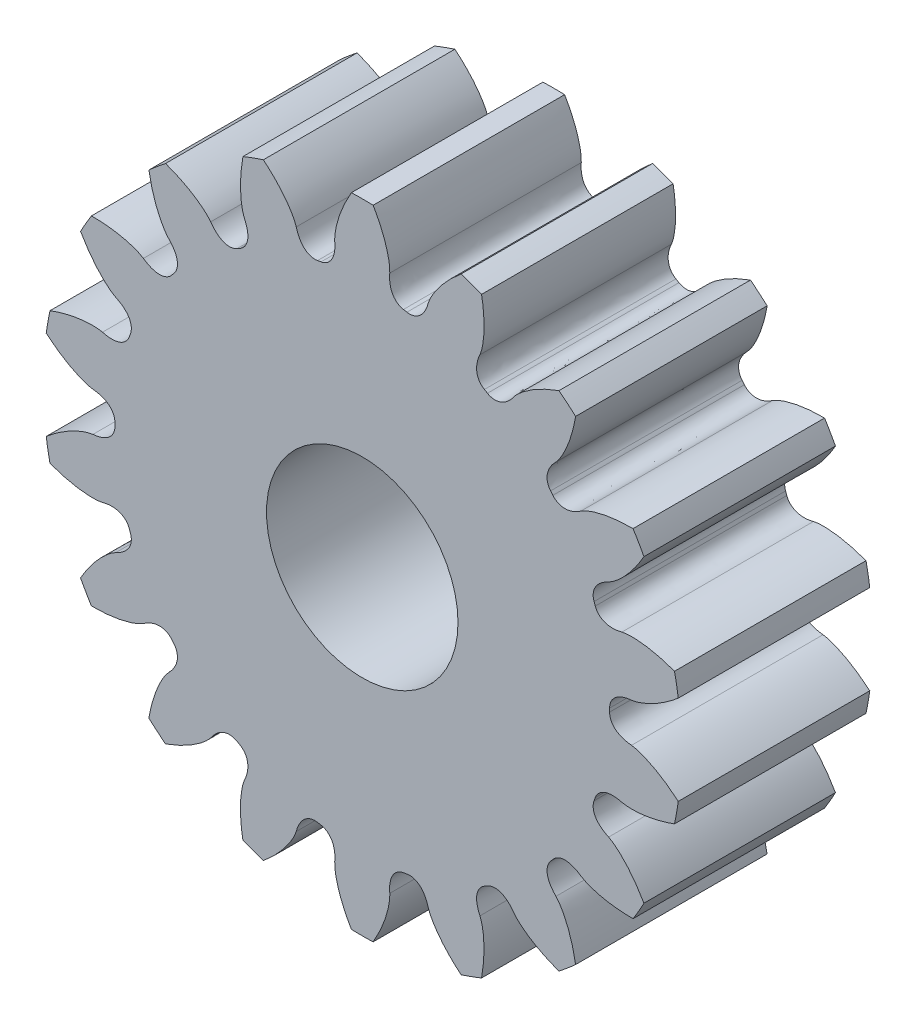
from build123d import *

# Parameters (mm, degrees)
EXTRUDE1_DEPTH = 3
SKETCH2_R      = 1.5
EXTRUDE2_DEPTH = 8.649188423


with BuildPart() as part:
    # Model → Extrude1 (new body)
    with BuildSketch(Plane.XY):
        with BuildLine():
            ThreePointArc((0.170382954, 4.997096122), (0, 5), (-0.170382954, 4.997096122))
            add(Edge.make_bspline(
                [(-0.43135347, 4.207267466), (-0.431951062, 4.236199501), (-0.430964789, 4.264988509), (-0.428394651, 4.293634492), (-0.425770912, 4.322877894), (-0.420909378, 4.352020022), (-0.415571578, 4.380917537), (-0.41012826, 4.410386301), (-0.403350915, 4.43967045), (-0.395923916, 4.46870975), (-0.388353419, 4.498310119), (-0.379730019, 4.52768866), (-0.370476347, 4.556810235), (-0.361047462, 4.586483212), (-0.350716716, 4.615909272), (-0.339787808, 4.645065279), (-0.328655911, 4.67476282), (-0.316719407, 4.704193559), (-0.304215266, 4.733341371), (-0.291483172, 4.763020553), (-0.278015717, 4.792415808), (-0.26400773, 4.821515626), (-0.249748986, 4.85113636), (-0.234807532, 4.880457696), (-0.219349459, 4.909471425), (-0.203619566, 4.938995344), (-0.187297397, 4.968203576), (-0.170382954, 4.997096122)],
                knots=[0, 0, 0, 0, 1, 1, 1, 2, 2, 2, 3, 3, 3, 4, 4, 4, 5, 5, 5, 6, 6, 6, 7, 7, 7, 8, 8, 8, 9, 9, 9, 9], degree=3))
            add(Edge.make_bspline(
                [(-0.43135347, 4.207267466), (-0.426410983, 4.162768285), (-0.427129765, 4.118945491), (-0.433509815, 4.075799084), (-0.437167481, 4.051063365), (-0.442075917, 4.025979343), (-0.450064877, 4.00225885), (-0.45584876, 3.98508558), (-0.46276282, 3.967979094), (-0.471301457, 3.951985875), (-0.478339128, 3.938804027), (-0.486355451, 3.925906001), (-0.495389481, 3.913998251), (-0.503410661, 3.903425539), (-0.512275301, 3.893279379), (-0.52182913, 3.884065211), (-0.530697966, 3.875511683), (-0.540288786, 3.867492833), (-0.550350294, 3.860378481), (-0.559957369, 3.853585452), (-0.570172172, 3.847415715), (-0.580688018, 3.842136144), (-0.590923912, 3.836997125), (-0.601655598, 3.832557088), (-0.612541957, 3.828996435), (-0.623293412, 3.825479906), (-0.634306636, 3.822762449), (-0.645581629, 3.820844064)],
                knots=[0, 0, 0, 0, 1, 1, 1, 2, 2, 2, 3, 3, 3, 4, 4, 4, 5, 5, 5, 6, 6, 6, 7, 7, 7, 8, 8, 8, 9, 9, 9, 9], degree=3))
            ThreePointArc((-0.645581629, 3.820844064), (-0.672886688, 3.816130043), (-0.700157341, 3.811220893))
            add(Edge.make_bspline(
                [(-1.033630549, 4.101069767), (-1.023055352, 4.057563785), (-1.007391639, 4.016629667), (-0.986639413, 3.978267412), (-0.974742217, 3.956274435), (-0.961550555, 3.934381948), (-0.945930501, 3.914824361), (-0.934621825, 3.900664971), (-0.922273971, 3.88695488), (-0.908780274, 3.874846556), (-0.897658569, 3.864866696), (-0.885714305, 3.85548826), (-0.873152403, 3.847388455), (-0.861998879, 3.840196761), (-0.850198651, 3.833694375), (-0.838069558, 3.828303491), (-0.826810099, 3.823299124), (-0.815055067, 3.819044124), (-0.803167091, 3.815800059), (-0.791816041, 3.812702513), (-0.780107092, 3.810398525), (-0.768419709, 3.809033981), (-0.757043467, 3.807705765), (-0.745440399, 3.807203948), (-0.733992753, 3.807581383), (-0.722686966, 3.807954141), (-0.711408495, 3.809167311), (-0.700157341, 3.811220893)],
                knots=[0, 0, 0, 0, 1, 1, 1, 2, 2, 2, 3, 3, 3, 4, 4, 4, 5, 5, 5, 6, 6, 6, 7, 7, 7, 8, 8, 8, 9, 9, 9, 9], degree=3))
            add(Edge.make_bspline(
                [(-1.033630549, 4.101069767), (-1.042964335, 4.128461375), (-1.053737549, 4.155176869), (-1.065950192, 4.181216248), (-1.078417533, 4.207798686), (-1.092953075, 4.233520587), (-1.107852498, 4.258849733), (-1.123046455, 4.284679588), (-1.139430845, 4.309879699), (-1.156341967, 4.334627531), (-1.17357983, 4.359853517), (-1.191731228, 4.384510939), (-1.210387, 4.408711326), (-1.229396009, 4.433369934), (-1.249168041, 4.457488062), (-1.269409797, 4.481147841), (-1.290027516, 4.505247067), (-1.311310066, 4.528820391), (-1.333029253, 4.551933707), (-1.355144386, 4.575468383), (-1.377853424, 4.598484746), (-1.400969349, 4.621038616), (-1.424499074, 4.643996224), (-1.448567936, 4.666438989), (-1.473017052, 4.688416004), (-1.497896092, 4.710779472), (-1.523223717, 4.732643722), (-1.548999928, 4.754008753)],
                knots=[0, 0, 0, 0, 1, 1, 1, 2, 2, 2, 3, 3, 3, 4, 4, 4, 5, 5, 5, 6, 6, 6, 7, 7, 7, 8, 8, 8, 9, 9, 9, 9], degree=3))
            ThreePointArc((-1.548999928, 4.754008753), (-1.710100717, 4.698463104), (-1.869215136, 4.637459949))
            add(Edge.make_bspline(
                [(-1.844309894, 3.806006616), (-1.854766786, 3.832989447), (-1.863686414, 3.860379591), (-1.871068777, 3.888177048), (-1.878605101, 3.91655423), (-1.884003949, 3.945601615), (-1.888871589, 3.974582031), (-1.893835454, 4.004135335), (-1.897482602, 4.033971423), (-1.900435531, 4.063799622), (-1.903445513, 4.094204133), (-1.905390221, 4.124760307), (-1.90665478, 4.155290579), (-1.907943282, 4.186398925), (-1.908299861, 4.2175837), (-1.908001988, 4.248719291), (-1.907698584, 4.280433184), (-1.906547845, 4.312171557), (-1.904766935, 4.343838209), (-1.902953558, 4.37608215), (-1.90035206, 4.408310795), (-1.897141581, 4.440446693), (-1.893873632, 4.473157856), (-1.889861745, 4.505821177), (-1.885259189, 4.538372137), (-1.880575699, 4.571495486), (-1.875227681, 4.604524757), (-1.869215136, 4.637459949)],
                knots=[0, 0, 0, 0, 1, 1, 1, 2, 2, 2, 3, 3, 3, 4, 4, 4, 5, 5, 5, 6, 6, 6, 7, 7, 7, 8, 8, 8, 9, 9, 9, 9], degree=3))
            add(Edge.make_bspline(
                [(-1.844309894, 3.806006616), (-1.824445859, 3.765881494), (-1.810133015, 3.7244557), (-1.801371361, 3.681729234), (-1.796348328, 3.657234266), (-1.792381509, 3.631984211), (-1.791775789, 3.606961854), (-1.791337258, 3.588846055), (-1.791983586, 3.570406468), (-1.794537277, 3.552457372), (-1.796642067, 3.537663462), (-1.799763561, 3.522801538), (-1.804180083, 3.508522093), (-1.808101446, 3.495843588), (-1.812961291, 3.483277431), (-1.818787523, 3.471351344), (-1.824196023, 3.460280336), (-1.830465839, 3.449464828), (-1.837487312, 3.439338286), (-1.844191657, 3.429669113), (-1.851680257, 3.420377789), (-1.8597562, 3.411819983), (-1.867617146, 3.403490003), (-1.87618305, 3.39564728), (-1.885195066, 3.388578007), (-1.894095406, 3.381596337), (-1.903515026, 3.375276018), (-1.913453928, 3.369617051)],
                knots=[0, 0, 0, 0, 1, 1, 1, 2, 2, 2, 3, 3, 3, 4, 4, 4, 5, 5, 5, 6, 6, 6, 7, 7, 7, 8, 8, 8, 9, 9, 9, 9], degree=3))
            ThreePointArc((-1.913453928, 3.369617051), (-1.9375, 3.35584844), (-1.961447003, 3.341908235))
            add(Edge.make_bspline(
                [(-2.373943469, 3.500222529), (-2.349126112, 3.462957209), (-2.320406744, 3.429849025), (-2.287785366, 3.400897977), (-2.269083617, 3.384300419), (-2.249199838, 3.368240026), (-2.227832701, 3.355204278), (-2.212363225, 3.345766599), (-2.19607091, 3.337106542), (-2.179249692, 3.330343556), (-2.165385394, 3.324769402), (-2.150953843, 3.320041734), (-2.136379221, 3.316726831), (-2.123438632, 3.313783578), (-2.110126099, 3.31170925), (-2.096884688, 3.31079187), (-2.084592663, 3.309940266), (-2.072091251, 3.309962331), (-2.059810672, 3.310979834), (-2.048084751, 3.311951381), (-2.036293927, 3.313791036), (-2.024844678, 3.316506106), (-2.013700231, 3.319148895), (-2.002625282, 3.322645824), (-1.991997104, 3.326915822), (-1.98150063, 3.331132907), (-1.971317263, 3.336130378), (-1.961447003, 3.341908235)],
                knots=[0, 0, 0, 0, 1, 1, 1, 2, 2, 2, 3, 3, 3, 4, 4, 4, 5, 5, 5, 6, 6, 6, 7, 7, 7, 8, 8, 8, 9, 9, 9, 9], degree=3))
            add(Edge.make_bspline(
                [(-2.373943469, 3.500222529), (-2.39208284, 3.522769878), (-2.411343587, 3.544189574), (-2.43172571, 3.564481617), (-2.452532908, 3.585196856), (-2.474989257, 3.604396088), (-2.497653214, 3.623101797), (-2.520765194, 3.642177282), (-2.544780429, 3.660253848), (-2.569135943, 3.677725259), (-2.593962031, 3.695534236), (-2.6194521, 3.712496489), (-2.645259812, 3.728856765), (-2.671556178, 3.745526813), (-2.698384696, 3.761428007), (-2.725497846, 3.776737838), (-2.753114585, 3.792332028), (-2.781176191, 3.807204646), (-2.809490771, 3.821495658), (-2.838321532, 3.836047199), (-2.867533107, 3.849908557), (-2.89696885, 3.863196151), (-2.926931522, 3.876721605), (-2.957224732, 3.88957887), (-2.987715968, 3.901868418), (-3.018743375, 3.914374072), (-3.050021571, 3.926257188), (-3.081550557, 3.937517767)],
                knots=[0, 0, 0, 0, 1, 1, 1, 2, 2, 2, 3, 3, 3, 4, 4, 4, 5, 5, 5, 6, 6, 6, 7, 7, 7, 8, 8, 8, 9, 9, 9, 9], degree=3))
            ThreePointArc((-3.081550557, 3.937517767), (-3.213938048, 3.830222216), (-3.342592386, 3.718477664))
            add(Edge.make_bspline(
                [(-3.034815326, 2.945685197), (-3.053870262, 2.967464297), (-3.071619951, 2.990151921), (-3.088064394, 3.013748069), (-3.10485179, 3.037836323), (-3.119859838, 3.063285421), (-3.13434581, 3.088853274), (-3.149118143, 3.114926554), (-3.162749884, 3.141715907), (-3.175726574, 3.168735285), (-3.188953987, 3.196276704), (-3.201232242, 3.224324987), (-3.212862506, 3.252581553), (-3.224712983, 3.281373143), (-3.235713879, 3.310555288), (-3.24608297, 3.339915052), (-3.256644653, 3.369820134), (-3.266418475, 3.400038025), (-3.2755756, 3.430404051), (-3.284899661, 3.461323655), (-3.293477897, 3.492498441), (-3.301452159, 3.523794355), (-3.309569168, 3.555650497), (-3.316970741, 3.587716126), (-3.323778837, 3.619878189), (-3.330706648, 3.652605804), (-3.336977831, 3.685472296), (-3.342592386, 3.718477664)],
                knots=[0, 0, 0, 0, 1, 1, 1, 2, 2, 2, 3, 3, 3, 4, 4, 4, 5, 5, 5, 6, 6, 6, 7, 7, 7, 8, 8, 8, 9, 9, 9, 9], degree=3))
            add(Edge.make_bspline(
                [(-3.034815326, 2.945685197), (-3.002425639, 2.914773816), (-2.974807509, 2.880741585), (-2.951960936, 2.843588502), (-2.938863056, 2.822288739), (-2.926499438, 2.799918181), (-2.917372097, 2.776612025), (-2.910764044, 2.759738729), (-2.905064684, 2.742190128), (-2.901325417, 2.724450082), (-2.898243457, 2.709828473), (-2.896093624, 2.694795218), (-2.895359939, 2.67986639), (-2.894708511, 2.666611307), (-2.894977393, 2.653140818), (-2.896373298, 2.639941273), (-2.897669118, 2.627688112), (-2.899861696, 2.615380456), (-2.902996241, 2.603463134), (-2.905989213, 2.592084063), (-2.909848375, 2.580791821), (-2.914510337, 2.569987979), (-2.919048189, 2.559471757), (-2.924415137, 2.549172296), (-2.930465828, 2.539447062), (-2.93644154, 2.529842342), (-2.943131411, 2.520681485), (-2.950535442, 2.511964491)],
                knots=[0, 0, 0, 0, 1, 1, 1, 2, 2, 2, 3, 3, 3, 4, 4, 4, 5, 5, 5, 6, 6, 6, 7, 7, 7, 8, 8, 8, 9, 9, 9, 9], degree=3))
            ThreePointArc((-2.950535442, 2.511964491), (-2.968422217, 2.490801988), (-2.986157208, 2.469512123))
            add(Edge.make_bspline(
                [(-3.427923771, 2.477196796), (-3.391857593, 2.450666886), (-3.35354655, 2.429377972), (-3.31299064, 2.413330055), (-3.289740046, 2.404129826), (-3.265562427, 2.395838646), (-3.241025398, 2.390897042), (-3.223260969, 2.387319397), (-3.204989287, 2.384753905), (-3.186869435, 2.384151972), (-3.171934784, 2.38365585), (-3.156756604, 2.384149176), (-3.141927175, 2.386019001), (-3.128760348, 2.38767919), (-3.115541196, 2.390283114), (-3.102784578, 2.393949888), (-3.090942587, 2.397353761), (-3.079202649, 2.401650231), (-3.068010686, 2.406806576), (-3.057324213, 2.411730033), (-3.046873662, 2.417491443), (-3.037043496, 2.423958647), (-3.027475028, 2.430253682), (-3.018264, 2.437327576), (-3.009737206, 2.444975113), (-3.001316074, 2.452527882), (-2.993456075, 2.460706885), (-2.986157208, 2.469512123)],
                knots=[0, 0, 0, 0, 1, 1, 1, 2, 2, 2, 3, 3, 3, 4, 4, 4, 5, 5, 5, 6, 6, 6, 7, 7, 7, 8, 8, 8, 9, 9, 9, 9], degree=3))
            add(Edge.make_bspline(
                [(-3.427923771, 2.477196796), (-3.452680852, 2.492180344), (-3.478106001, 2.505720711), (-3.504199219, 2.517817897), (-3.530836618, 2.530167373), (-3.558505208, 2.540528226), (-3.58620009, 2.550354312), (-3.614442447, 2.560374642), (-3.643191937, 2.569147364), (-3.672054208, 2.577235044), (-3.701474128, 2.585478986), (-3.73122839, 2.592700173), (-3.76107525, 2.599247046), (-3.791487244, 2.60591788), (-3.822136333, 2.611684221), (-3.85285063, 2.616797513), (-3.884135403, 2.622005777), (-3.915591423, 2.626383832), (-3.947086239, 2.630128834), (-3.979155211, 2.633942109), (-4.011345977, 2.636976578), (-4.043551152, 2.639395214), (-4.076332832, 2.641857146), (-4.109196581, 2.643578135), (-4.142052244, 2.644697917), (-4.175485654, 2.645837388), (-4.20894181, 2.646306092), (-4.24242071, 2.646104027)],
                knots=[0, 0, 0, 0, 1, 1, 1, 2, 2, 2, 3, 3, 3, 4, 4, 4, 5, 5, 5, 6, 6, 6, 7, 7, 7, 8, 8, 8, 9, 9, 9, 9], degree=3))
            ThreePointArc((-4.24242071, 2.646104027), (-4.330127019, 2.5), (-4.412803663, 2.350992095))
            add(Edge.make_bspline(
                [(-3.859277241, 1.73007067), (-3.884631914, 1.744019157), (-3.909070791, 1.759267799), (-3.93259387, 1.775816595), (-3.95660753, 1.792710521), (-3.979414586, 1.811491797), (-4.001771668, 1.830563225), (-4.024570707, 1.850011658), (-4.046542852, 1.870523086), (-4.067978123, 1.891474706), (-4.089827546, 1.912831133), (-4.11095841, 1.934988487), (-4.131551598, 1.957563189), (-4.152534707, 1.980565332), (-4.172853049, 2.00422505), (-4.192638438, 2.028267766), (-4.212791314, 2.052757042), (-4.23231083, 2.077809727), (-4.251301505, 2.103212537), (-4.270638384, 2.129078444), (-4.289361694, 2.15543923), (-4.307558882, 2.182120412), (-4.326081818, 2.209279213), (-4.344004113, 2.236879561), (-4.361401703, 2.264773509), (-4.37910522, 2.293157956), (-4.396239207, 2.321897484), (-4.412803663, 2.350992095)],
                knots=[0, 0, 0, 0, 1, 1, 1, 2, 2, 2, 3, 3, 3, 4, 4, 4, 5, 5, 5, 6, 6, 6, 7, 7, 7, 8, 8, 8, 9, 9, 9, 9], degree=3))
            add(Edge.make_bspline(
                [(-3.859277241, 1.73007067), (-3.818268576, 1.712101399), (-3.780676314, 1.689567519), (-3.746500455, 1.662469029), (-3.726907527, 1.646933538), (-3.707638344, 1.630140697), (-3.691090275, 1.611361808), (-3.679109729, 1.597766184), (-3.667752107, 1.583225188), (-3.658170892, 1.567833903), (-3.650273912, 1.555148177), (-3.643112055, 1.541756825), (-3.637316656, 1.52797925), (-3.632171009, 1.515746348), (-3.627816497, 1.502996265), (-3.624613707, 1.490115323), (-3.621640553, 1.478157921), (-3.619491436, 1.465842602), (-3.61836098, 1.453571905), (-3.617281582, 1.441855419), (-3.617045834, 1.429924272), (-3.617731514, 1.418177497), (-3.61839894, 1.406743443), (-3.619919599, 1.395229511), (-3.622279162, 1.384021322), (-3.624609487, 1.372952024), (-3.627762712, 1.362055564), (-3.631738838, 1.351331941)],
                knots=[0, 0, 0, 0, 1, 1, 1, 2, 2, 2, 3, 3, 3, 4, 4, 4, 5, 5, 5, 6, 6, 6, 7, 7, 7, 8, 8, 8, 9, 9, 9, 9], degree=3))
            ThreePointArc((-3.631738838, 1.351331941), (-3.641308906, 1.325328055), (-3.650692784, 1.299256403))
            add(Edge.make_bspline(
                [(-4.068445875, 1.15538457), (-4.025480991, 1.142789968), (-3.982199149, 1.135888082), (-3.938600348, 1.13467891), (-3.913605273, 1.133985695), (-3.888049993, 1.134463767), (-3.863302599, 1.138212336), (-3.845385869, 1.140926242), (-3.827338655, 1.144764752), (-3.81010569, 1.150396474), (-3.795902025, 1.155038224), (-3.781807929, 1.160693041), (-3.768512342, 1.167522065), (-3.75670739, 1.173585453), (-3.745176045, 1.180553557), (-3.734442856, 1.188362218), (-3.724479217, 1.195611012), (-3.714916763, 1.203663668), (-3.706163332, 1.212336925), (-3.697805254, 1.22061845), (-3.689955467, 1.229606703), (-3.682930046, 1.239046002), (-3.676091656, 1.248234008), (-3.669855536, 1.258031652), (-3.664458581, 1.268134322), (-3.659128505, 1.278111799), (-3.654539906, 1.288485826), (-3.650692784, 1.299256403)],
                knots=[0, 0, 0, 0, 1, 1, 1, 2, 2, 2, 3, 3, 3, 4, 4, 4, 5, 5, 5, 6, 6, 6, 7, 7, 7, 8, 8, 8, 9, 9, 9, 9], degree=3))
            add(Edge.make_bspline(
                [(-4.068445875, 1.15538457), (-4.096834597, 1.160997079), (-4.1253575, 1.165024948), (-4.154014586, 1.167468179), (-4.183269323, 1.169962364), (-4.212812913, 1.170235165), (-4.242198309, 1.169996459), (-4.272164598, 1.169753034), (-4.302180729, 1.168163792), (-4.332068541, 1.165892246), (-4.362533817, 1.163576812), (-4.39296347, 1.160185952), (-4.423249506, 1.156129773), (-4.454108992, 1.151996792), (-4.48488192, 1.146932774), (-4.515492767, 1.141232789), (-4.546672168, 1.135426933), (-4.577728541, 1.128782367), (-4.608604853, 1.121529656), (-4.640044047, 1.114144727), (-4.671331321, 1.105986306), (-4.702421508, 1.097244262), (-4.734068242, 1.088345726), (-4.765538677, 1.078722863), (-4.796795889, 1.068537814), (-4.82860274, 1.058173668), (-4.860201549, 1.047171426), (-4.891592314, 1.035531089)],
                knots=[0, 0, 0, 0, 1, 1, 1, 2, 2, 2, 3, 3, 3, 4, 4, 4, 5, 5, 5, 6, 6, 6, 7, 7, 7, 8, 8, 8, 9, 9, 9, 9], degree=3))
            ThreePointArc((-4.891592314, 1.035531089), (-4.924038765, 0.868240888), (-4.950765693, 0.699942181))
            add(Edge.make_bspline(
                [(-4.218253363, 0.305784087), (-4.246849626, 0.310219568), (-4.275030001, 0.316190016), (-4.302794487, 0.323695431), (-4.331138009, 0.331357374), (-4.358993206, 0.341205527), (-4.386524803, 0.351480235), (-4.414600648, 0.361958054), (-4.442263032, 0.373717574), (-4.469571474, 0.386074363), (-4.497407544, 0.398669897), (-4.524842321, 0.412263818), (-4.551914591, 0.426433814), (-4.57949946, 0.440872112), (-4.606684557, 0.456155692), (-4.633499834, 0.471981453), (-4.660813168, 0.488101156), (-4.687724036, 0.504966911), (-4.714257706, 0.522342551), (-4.74127509, 0.540034951), (-4.767885166, 0.558402238), (-4.794110431, 0.577250542), (-4.820805154, 0.596436251), (-4.847086477, 0.616242308), (-4.872975156, 0.636503718), (-4.899319073, 0.657121414), (-4.925249252, 0.678267569), (-4.950765693, 0.699942181)],
                knots=[0, 0, 0, 0, 1, 1, 1, 2, 2, 2, 3, 3, 3, 4, 4, 4, 5, 5, 5, 6, 6, 6, 7, 7, 7, 8, 8, 8, 9, 9, 9, 9], degree=3))
            add(Edge.make_bspline(
                [(-4.218253363, 0.305784087), (-4.173571971, 0.302924285), (-4.130539759, 0.294606675), (-4.089156727, 0.280831257), (-4.065431946, 0.272933846), (-4.041581347, 0.263744186), (-4.01960849, 0.251757575), (-4.003700482, 0.243079456), (-3.988054496, 0.233299925), (-3.973786969, 0.222113816), (-3.962027461, 0.212894059), (-3.950717405, 0.202759804), (-3.940559303, 0.191795262), (-3.931540078, 0.18206001), (-3.92308739, 0.171568182), (-3.91567221, 0.160559473), (-3.908788686, 0.15034007), (-3.90255709, 0.139502497), (-3.897297983, 0.128358452), (-3.892276407, 0.117717733), (-3.887974184, 0.106586752), (-3.884600879, 0.095313877), (-3.881317377, 0.084341108), (-3.878808332, 0.073001456), (-3.87719217, 0.061662185), (-3.875596036, 0.05046343), (-3.874832289, 0.03914564), (-3.874900931, 0.027708815)],
                knots=[0, 0, 0, 0, 1, 1, 1, 2, 2, 2, 3, 3, 3, 4, 4, 4, 5, 5, 5, 6, 6, 6, 7, 7, 7, 8, 8, 8, 9, 9, 9, 9], degree=3))
            ThreePointArc((-3.874900931, 0.027708815), (-3.875, 0), (-3.874900931, -0.027708815))
            add(Edge.make_bspline(
                [(-4.218253363, -0.305784087), (-4.173571971, -0.302924285), (-4.130539759, -0.294606675), (-4.089156727, -0.280831257), (-4.065431946, -0.272933846), (-4.041581347, -0.263744186), (-4.01960849, -0.251757575), (-4.003700482, -0.243079456), (-3.988054496, -0.233299925), (-3.973786969, -0.222113816), (-3.962027461, -0.212894059), (-3.950717405, -0.202759804), (-3.940559303, -0.191795262), (-3.931540078, -0.18206001), (-3.92308739, -0.171568182), (-3.91567221, -0.160559473), (-3.908788686, -0.15034007), (-3.90255709, -0.139502497), (-3.897297983, -0.128358452), (-3.892276407, -0.117717733), (-3.887974184, -0.106586752), (-3.884600879, -0.095313877), (-3.881317377, -0.084341108), (-3.878808332, -0.073001456), (-3.87719217, -0.061662185), (-3.875596036, -0.05046343), (-3.874832289, -0.03914564), (-3.874900931, -0.027708815)],
                knots=[0, 0, 0, 0, 1, 1, 1, 2, 2, 2, 3, 3, 3, 4, 4, 4, 5, 5, 5, 6, 6, 6, 7, 7, 7, 8, 8, 8, 9, 9, 9, 9], degree=3))
            add(Edge.make_bspline(
                [(-4.218253363, -0.305784087), (-4.246849626, -0.310219568), (-4.275030001, -0.316190016), (-4.302794487, -0.323695431), (-4.331138009, -0.331357374), (-4.358993206, -0.341205527), (-4.386524803, -0.351480235), (-4.414600648, -0.361958054), (-4.442263032, -0.373717574), (-4.469571474, -0.386074363), (-4.497407544, -0.398669897), (-4.524842321, -0.412263818), (-4.551914591, -0.426433814), (-4.57949946, -0.440872112), (-4.606684557, -0.456155692), (-4.633499834, -0.471981453), (-4.660813168, -0.488101156), (-4.687724036, -0.504966911), (-4.714257706, -0.522342551), (-4.74127509, -0.540034951), (-4.767885166, -0.558402238), (-4.794110431, -0.577250542), (-4.820805154, -0.596436251), (-4.847086477, -0.616242308), (-4.872975156, -0.636503718), (-4.899319073, -0.657121414), (-4.925249252, -0.678267569), (-4.950765693, -0.699942181)],
                knots=[0, 0, 0, 0, 1, 1, 1, 2, 2, 2, 3, 3, 3, 4, 4, 4, 5, 5, 5, 6, 6, 6, 7, 7, 7, 8, 8, 8, 9, 9, 9, 9], degree=3))
            ThreePointArc((-4.950765693, -0.699942181), (-4.924038765, -0.868240888), (-4.891592314, -1.035531089))
            add(Edge.make_bspline(
                [(-4.068445875, -1.15538457), (-4.096834597, -1.160997079), (-4.1253575, -1.165024948), (-4.154014586, -1.167468179), (-4.183269323, -1.169962364), (-4.212812913, -1.170235165), (-4.242198309, -1.169996459), (-4.272164598, -1.169753034), (-4.302180729, -1.168163792), (-4.332068541, -1.165892246), (-4.362533817, -1.163576812), (-4.39296347, -1.160185952), (-4.423249506, -1.156129773), (-4.454108992, -1.151996792), (-4.48488192, -1.146932774), (-4.515492767, -1.141232789), (-4.546672168, -1.135426933), (-4.577728541, -1.128782367), (-4.608604853, -1.121529656), (-4.640044047, -1.114144727), (-4.671331321, -1.105986306), (-4.702421508, -1.097244262), (-4.734068242, -1.088345726), (-4.765538677, -1.078722863), (-4.796795889, -1.068537814), (-4.82860274, -1.058173668), (-4.860201549, -1.047171426), (-4.891592314, -1.035531089)],
                knots=[0, 0, 0, 0, 1, 1, 1, 2, 2, 2, 3, 3, 3, 4, 4, 4, 5, 5, 5, 6, 6, 6, 7, 7, 7, 8, 8, 8, 9, 9, 9, 9], degree=3))
            add(Edge.make_bspline(
                [(-4.068445875, -1.15538457), (-4.025480991, -1.142789968), (-3.982199149, -1.135888082), (-3.938600348, -1.13467891), (-3.913605273, -1.133985695), (-3.888049993, -1.134463767), (-3.863302599, -1.138212336), (-3.845385869, -1.140926242), (-3.827338655, -1.144764752), (-3.81010569, -1.150396474), (-3.795902025, -1.155038224), (-3.781807929, -1.160693041), (-3.768512342, -1.167522065), (-3.75670739, -1.173585453), (-3.745176045, -1.180553557), (-3.734442856, -1.188362218), (-3.724479217, -1.195611012), (-3.714916763, -1.203663668), (-3.706163332, -1.212336925), (-3.697805254, -1.22061845), (-3.689955467, -1.229606703), (-3.682930046, -1.239046002), (-3.676091656, -1.248234008), (-3.669855536, -1.258031652), (-3.664458581, -1.268134322), (-3.659128505, -1.278111799), (-3.654539906, -1.288485826), (-3.650692784, -1.299256403)],
                knots=[0, 0, 0, 0, 1, 1, 1, 2, 2, 2, 3, 3, 3, 4, 4, 4, 5, 5, 5, 6, 6, 6, 7, 7, 7, 8, 8, 8, 9, 9, 9, 9], degree=3))
            ThreePointArc((-3.650692784, -1.299256403), (-3.641308906, -1.325328055), (-3.631738838, -1.351331941))
            add(Edge.make_bspline(
                [(-3.859277241, -1.73007067), (-3.818268576, -1.712101399), (-3.780676314, -1.689567519), (-3.746500455, -1.662469029), (-3.726907527, -1.646933538), (-3.707638344, -1.630140697), (-3.691090275, -1.611361808), (-3.679109729, -1.597766184), (-3.667752107, -1.583225188), (-3.658170892, -1.567833903), (-3.650273912, -1.555148177), (-3.643112055, -1.541756825), (-3.637316656, -1.52797925), (-3.632171009, -1.515746348), (-3.627816497, -1.502996265), (-3.624613707, -1.490115323), (-3.621640553, -1.478157921), (-3.619491436, -1.465842602), (-3.61836098, -1.453571905), (-3.617281582, -1.441855419), (-3.617045834, -1.429924272), (-3.617731514, -1.418177497), (-3.61839894, -1.406743443), (-3.619919599, -1.395229511), (-3.622279162, -1.384021322), (-3.624609487, -1.372952024), (-3.627762712, -1.362055564), (-3.631738838, -1.351331941)],
                knots=[0, 0, 0, 0, 1, 1, 1, 2, 2, 2, 3, 3, 3, 4, 4, 4, 5, 5, 5, 6, 6, 6, 7, 7, 7, 8, 8, 8, 9, 9, 9, 9], degree=3))
            add(Edge.make_bspline(
                [(-3.859277241, -1.73007067), (-3.884631914, -1.744019157), (-3.909070791, -1.759267799), (-3.93259387, -1.775816595), (-3.95660753, -1.792710521), (-3.979414586, -1.811491797), (-4.001771668, -1.830563225), (-4.024570707, -1.850011658), (-4.046542852, -1.870523086), (-4.067978123, -1.891474706), (-4.089827546, -1.912831133), (-4.11095841, -1.934988487), (-4.131551598, -1.957563189), (-4.152534707, -1.980565332), (-4.172853049, -2.00422505), (-4.192638438, -2.028267766), (-4.212791314, -2.052757042), (-4.23231083, -2.077809727), (-4.251301505, -2.103212537), (-4.270638384, -2.129078444), (-4.289361694, -2.15543923), (-4.307558882, -2.182120412), (-4.326081818, -2.209279213), (-4.344004113, -2.236879561), (-4.361401703, -2.264773509), (-4.37910522, -2.293157956), (-4.396239207, -2.321897484), (-4.412803663, -2.350992095)],
                knots=[0, 0, 0, 0, 1, 1, 1, 2, 2, 2, 3, 3, 3, 4, 4, 4, 5, 5, 5, 6, 6, 6, 7, 7, 7, 8, 8, 8, 9, 9, 9, 9], degree=3))
            ThreePointArc((-4.412803663, -2.350992095), (-4.330127019, -2.5), (-4.24242071, -2.646104027))
            add(Edge.make_bspline(
                [(-3.427923771, -2.477196796), (-3.452680852, -2.492180344), (-3.478106001, -2.505720711), (-3.504199219, -2.517817897), (-3.530836618, -2.530167373), (-3.558505208, -2.540528226), (-3.58620009, -2.550354312), (-3.614442447, -2.560374642), (-3.643191937, -2.569147364), (-3.672054208, -2.577235044), (-3.701474128, -2.585478986), (-3.73122839, -2.592700173), (-3.76107525, -2.599247046), (-3.791487244, -2.60591788), (-3.822136333, -2.611684221), (-3.85285063, -2.616797513), (-3.884135403, -2.622005777), (-3.915591423, -2.626383832), (-3.947086239, -2.630128834), (-3.979155211, -2.633942109), (-4.011345977, -2.636976578), (-4.043551152, -2.639395214), (-4.076332832, -2.641857146), (-4.109196581, -2.643578135), (-4.142052244, -2.644697917), (-4.175485654, -2.645837388), (-4.20894181, -2.646306092), (-4.24242071, -2.646104027)],
                knots=[0, 0, 0, 0, 1, 1, 1, 2, 2, 2, 3, 3, 3, 4, 4, 4, 5, 5, 5, 6, 6, 6, 7, 7, 7, 8, 8, 8, 9, 9, 9, 9], degree=3))
            add(Edge.make_bspline(
                [(-3.427923771, -2.477196796), (-3.391857593, -2.450666886), (-3.35354655, -2.429377972), (-3.31299064, -2.413330055), (-3.289740046, -2.404129826), (-3.265562427, -2.395838646), (-3.241025398, -2.390897042), (-3.223260969, -2.387319397), (-3.204989287, -2.384753905), (-3.186869435, -2.384151972), (-3.171934784, -2.38365585), (-3.156756604, -2.384149176), (-3.141927175, -2.386019001), (-3.128760348, -2.38767919), (-3.115541196, -2.390283114), (-3.102784578, -2.393949888), (-3.090942587, -2.397353761), (-3.079202649, -2.401650231), (-3.068010686, -2.406806576), (-3.057324213, -2.411730033), (-3.046873662, -2.417491443), (-3.037043496, -2.423958647), (-3.027475028, -2.430253682), (-3.018264, -2.437327576), (-3.009737206, -2.444975113), (-3.001316074, -2.452527882), (-2.993456075, -2.460706885), (-2.986157208, -2.469512123)],
                knots=[0, 0, 0, 0, 1, 1, 1, 2, 2, 2, 3, 3, 3, 4, 4, 4, 5, 5, 5, 6, 6, 6, 7, 7, 7, 8, 8, 8, 9, 9, 9, 9], degree=3))
            ThreePointArc((-2.986157208, -2.469512123), (-2.968422217, -2.490801988), (-2.950535442, -2.511964491))
            add(Edge.make_bspline(
                [(-3.034815326, -2.945685197), (-3.002425639, -2.914773816), (-2.974807509, -2.880741585), (-2.951960936, -2.843588502), (-2.938863056, -2.822288739), (-2.926499438, -2.799918181), (-2.917372097, -2.776612025), (-2.910764044, -2.759738729), (-2.905064684, -2.742190128), (-2.901325417, -2.724450082), (-2.898243457, -2.709828473), (-2.896093624, -2.694795218), (-2.895359939, -2.67986639), (-2.894708511, -2.666611307), (-2.894977393, -2.653140818), (-2.896373298, -2.639941273), (-2.897669118, -2.627688112), (-2.899861696, -2.615380456), (-2.902996241, -2.603463134), (-2.905989213, -2.592084063), (-2.909848375, -2.580791821), (-2.914510337, -2.569987979), (-2.919048189, -2.559471757), (-2.924415137, -2.549172296), (-2.930465828, -2.539447062), (-2.93644154, -2.529842342), (-2.943131411, -2.520681485), (-2.950535442, -2.511964491)],
                knots=[0, 0, 0, 0, 1, 1, 1, 2, 2, 2, 3, 3, 3, 4, 4, 4, 5, 5, 5, 6, 6, 6, 7, 7, 7, 8, 8, 8, 9, 9, 9, 9], degree=3))
            add(Edge.make_bspline(
                [(-3.034815326, -2.945685197), (-3.053870262, -2.967464297), (-3.071619951, -2.990151921), (-3.088064394, -3.013748069), (-3.10485179, -3.037836323), (-3.119859838, -3.063285421), (-3.13434581, -3.088853274), (-3.149118143, -3.114926554), (-3.162749884, -3.141715907), (-3.175726574, -3.168735285), (-3.188953987, -3.196276704), (-3.201232242, -3.224324987), (-3.212862506, -3.252581553), (-3.224712983, -3.281373143), (-3.235713879, -3.310555288), (-3.24608297, -3.339915052), (-3.256644653, -3.369820134), (-3.266418475, -3.400038025), (-3.2755756, -3.430404051), (-3.284899661, -3.461323655), (-3.293477897, -3.492498441), (-3.301452159, -3.523794355), (-3.309569168, -3.555650497), (-3.316970741, -3.587716126), (-3.323778837, -3.619878189), (-3.330706648, -3.652605804), (-3.336977831, -3.685472296), (-3.342592386, -3.718477664)],
                knots=[0, 0, 0, 0, 1, 1, 1, 2, 2, 2, 3, 3, 3, 4, 4, 4, 5, 5, 5, 6, 6, 6, 7, 7, 7, 8, 8, 8, 9, 9, 9, 9], degree=3))
            ThreePointArc((-3.342592386, -3.718477664), (-3.213938048, -3.830222216), (-3.081550557, -3.937517767))
            add(Edge.make_bspline(
                [(-2.373943469, -3.500222529), (-2.39208284, -3.522769878), (-2.411343587, -3.544189574), (-2.43172571, -3.564481617), (-2.452532908, -3.585196856), (-2.474989257, -3.604396088), (-2.497653214, -3.623101797), (-2.520765194, -3.642177282), (-2.544780429, -3.660253848), (-2.569135943, -3.677725259), (-2.593962031, -3.695534236), (-2.6194521, -3.712496489), (-2.645259812, -3.728856765), (-2.671556178, -3.745526813), (-2.698384696, -3.761428007), (-2.725497846, -3.776737838), (-2.753114585, -3.792332028), (-2.781176191, -3.807204646), (-2.809490771, -3.821495658), (-2.838321532, -3.836047199), (-2.867533107, -3.849908557), (-2.89696885, -3.863196151), (-2.926931522, -3.876721605), (-2.957224732, -3.88957887), (-2.987715968, -3.901868418), (-3.018743375, -3.914374072), (-3.050021571, -3.926257188), (-3.081550557, -3.937517767)],
                knots=[0, 0, 0, 0, 1, 1, 1, 2, 2, 2, 3, 3, 3, 4, 4, 4, 5, 5, 5, 6, 6, 6, 7, 7, 7, 8, 8, 8, 9, 9, 9, 9], degree=3))
            add(Edge.make_bspline(
                [(-2.373943469, -3.500222529), (-2.349126112, -3.462957209), (-2.320406744, -3.429849025), (-2.287785366, -3.400897977), (-2.269083617, -3.384300419), (-2.249199838, -3.368240026), (-2.227832701, -3.355204278), (-2.212363225, -3.345766599), (-2.19607091, -3.337106542), (-2.179249692, -3.330343556), (-2.165385394, -3.324769402), (-2.150953843, -3.320041734), (-2.136379221, -3.316726831), (-2.123438632, -3.313783578), (-2.110126099, -3.31170925), (-2.096884688, -3.31079187), (-2.084592663, -3.309940266), (-2.072091251, -3.309962331), (-2.059810672, -3.310979834), (-2.048084751, -3.311951381), (-2.036293927, -3.313791036), (-2.024844678, -3.316506106), (-2.013700231, -3.319148895), (-2.002625282, -3.322645824), (-1.991997104, -3.326915822), (-1.98150063, -3.331132907), (-1.971317263, -3.336130378), (-1.961447003, -3.341908235)],
                knots=[0, 0, 0, 0, 1, 1, 1, 2, 2, 2, 3, 3, 3, 4, 4, 4, 5, 5, 5, 6, 6, 6, 7, 7, 7, 8, 8, 8, 9, 9, 9, 9], degree=3))
            ThreePointArc((-1.961447003, -3.341908235), (-1.9375, -3.35584844), (-1.913453928, -3.369617051))
            add(Edge.make_bspline(
                [(-1.844309894, -3.806006616), (-1.824445859, -3.765881494), (-1.810133015, -3.7244557), (-1.801371361, -3.681729234), (-1.796348328, -3.657234266), (-1.792381509, -3.631984211), (-1.791775789, -3.606961854), (-1.791337258, -3.588846055), (-1.791983586, -3.570406468), (-1.794537277, -3.552457372), (-1.796642067, -3.537663462), (-1.799763561, -3.522801538), (-1.804180083, -3.508522093), (-1.808101446, -3.495843588), (-1.812961291, -3.483277431), (-1.818787523, -3.471351344), (-1.824196023, -3.460280336), (-1.830465839, -3.449464828), (-1.837487312, -3.439338286), (-1.844191657, -3.429669113), (-1.851680257, -3.420377789), (-1.8597562, -3.411819983), (-1.867617146, -3.403490003), (-1.87618305, -3.39564728), (-1.885195066, -3.388578007), (-1.894095406, -3.381596337), (-1.903515026, -3.375276018), (-1.913453928, -3.369617051)],
                knots=[0, 0, 0, 0, 1, 1, 1, 2, 2, 2, 3, 3, 3, 4, 4, 4, 5, 5, 5, 6, 6, 6, 7, 7, 7, 8, 8, 8, 9, 9, 9, 9], degree=3))
            add(Edge.make_bspline(
                [(-1.844309894, -3.806006616), (-1.854766786, -3.832989447), (-1.863686414, -3.860379591), (-1.871068777, -3.888177048), (-1.878605101, -3.91655423), (-1.884003949, -3.945601615), (-1.888871589, -3.974582031), (-1.893835454, -4.004135335), (-1.897482602, -4.033971423), (-1.900435531, -4.063799622), (-1.903445513, -4.094204133), (-1.905390221, -4.124760307), (-1.90665478, -4.155290579), (-1.907943282, -4.186398925), (-1.908299861, -4.2175837), (-1.908001988, -4.248719291), (-1.907698584, -4.280433184), (-1.906547845, -4.312171557), (-1.904766935, -4.343838209), (-1.902953558, -4.37608215), (-1.90035206, -4.408310795), (-1.897141581, -4.440446693), (-1.893873632, -4.473157856), (-1.889861745, -4.505821177), (-1.885259189, -4.538372137), (-1.880575699, -4.571495486), (-1.875227681, -4.604524757), (-1.869215136, -4.637459949)],
                knots=[0, 0, 0, 0, 1, 1, 1, 2, 2, 2, 3, 3, 3, 4, 4, 4, 5, 5, 5, 6, 6, 6, 7, 7, 7, 8, 8, 8, 9, 9, 9, 9], degree=3))
            ThreePointArc((-1.869215136, -4.637459949), (-1.710100717, -4.698463104), (-1.548999928, -4.754008753))
            add(Edge.make_bspline(
                [(-1.033630549, -4.101069767), (-1.042964335, -4.128461375), (-1.053737549, -4.155176869), (-1.065950192, -4.181216248), (-1.078417533, -4.207798686), (-1.092953075, -4.233520587), (-1.107852498, -4.258849733), (-1.123046455, -4.284679588), (-1.139430845, -4.309879699), (-1.156341967, -4.334627531), (-1.17357983, -4.359853517), (-1.191731228, -4.384510939), (-1.210387, -4.408711326), (-1.229396009, -4.433369934), (-1.249168041, -4.457488062), (-1.269409797, -4.481147841), (-1.290027516, -4.505247067), (-1.311310066, -4.528820391), (-1.333029253, -4.551933707), (-1.355144386, -4.575468383), (-1.377853424, -4.598484746), (-1.400969349, -4.621038616), (-1.424499074, -4.643996224), (-1.448567936, -4.666438989), (-1.473017052, -4.688416004), (-1.497896092, -4.710779472), (-1.523223717, -4.732643722), (-1.548999928, -4.754008753)],
                knots=[0, 0, 0, 0, 1, 1, 1, 2, 2, 2, 3, 3, 3, 4, 4, 4, 5, 5, 5, 6, 6, 6, 7, 7, 7, 8, 8, 8, 9, 9, 9, 9], degree=3))
            add(Edge.make_bspline(
                [(-1.033630549, -4.101069767), (-1.023055352, -4.057563785), (-1.007391639, -4.016629667), (-0.986639413, -3.978267412), (-0.974742217, -3.956274435), (-0.961550555, -3.934381948), (-0.945930501, -3.914824361), (-0.934621825, -3.900664971), (-0.922273971, -3.88695488), (-0.908780274, -3.874846556), (-0.897658569, -3.864866696), (-0.885714305, -3.85548826), (-0.873152403, -3.847388455), (-0.861998879, -3.840196761), (-0.850198651, -3.833694375), (-0.838069558, -3.828303491), (-0.826810099, -3.823299124), (-0.815055067, -3.819044124), (-0.803167091, -3.815800059), (-0.791816041, -3.812702513), (-0.780107092, -3.810398525), (-0.768419709, -3.809033981), (-0.757043467, -3.807705765), (-0.745440399, -3.807203948), (-0.733992753, -3.807581383), (-0.722686966, -3.807954141), (-0.711408495, -3.809167311), (-0.700157341, -3.811220893)],
                knots=[0, 0, 0, 0, 1, 1, 1, 2, 2, 2, 3, 3, 3, 4, 4, 4, 5, 5, 5, 6, 6, 6, 7, 7, 7, 8, 8, 8, 9, 9, 9, 9], degree=3))
            ThreePointArc((-0.700157341, -3.811220893), (-0.672886688, -3.816130043), (-0.645581629, -3.820844064))
            add(Edge.make_bspline(
                [(-0.43135347, -4.207267466), (-0.426410983, -4.162768285), (-0.427129765, -4.118945491), (-0.433509815, -4.075799084), (-0.437167481, -4.051063365), (-0.442075917, -4.025979343), (-0.450064877, -4.00225885), (-0.45584876, -3.98508558), (-0.46276282, -3.967979094), (-0.471301457, -3.951985875), (-0.478339128, -3.938804027), (-0.486355451, -3.925906001), (-0.495389481, -3.913998251), (-0.503410661, -3.903425539), (-0.512275301, -3.893279379), (-0.52182913, -3.884065211), (-0.530697966, -3.875511683), (-0.540288786, -3.867492833), (-0.550350294, -3.860378481), (-0.559957369, -3.853585452), (-0.570172172, -3.847415715), (-0.580688018, -3.842136144), (-0.590923912, -3.836997125), (-0.601655598, -3.832557088), (-0.612541957, -3.828996435), (-0.623293412, -3.825479906), (-0.634306636, -3.822762449), (-0.645581629, -3.820844064)],
                knots=[0, 0, 0, 0, 1, 1, 1, 2, 2, 2, 3, 3, 3, 4, 4, 4, 5, 5, 5, 6, 6, 6, 7, 7, 7, 8, 8, 8, 9, 9, 9, 9], degree=3))
            add(Edge.make_bspline(
                [(-0.43135347, -4.207267466), (-0.431951062, -4.236199501), (-0.430964789, -4.264988509), (-0.428394651, -4.293634492), (-0.425770912, -4.322877894), (-0.420909378, -4.352020022), (-0.415571578, -4.380917537), (-0.41012826, -4.410386301), (-0.403350915, -4.43967045), (-0.395923916, -4.46870975), (-0.388353419, -4.498310119), (-0.379730019, -4.52768866), (-0.370476347, -4.556810235), (-0.361047462, -4.586483212), (-0.350716716, -4.615909272), (-0.339787808, -4.645065279), (-0.328655911, -4.67476282), (-0.316719407, -4.704193559), (-0.304215266, -4.733341371), (-0.291483172, -4.763020553), (-0.278015717, -4.792415808), (-0.26400773, -4.821515626), (-0.249748986, -4.85113636), (-0.234807532, -4.880457696), (-0.219349459, -4.909471425), (-0.203619566, -4.938995344), (-0.187297397, -4.968203576), (-0.170382954, -4.997096122)],
                knots=[0, 0, 0, 0, 1, 1, 1, 2, 2, 2, 3, 3, 3, 4, 4, 4, 5, 5, 5, 6, 6, 6, 7, 7, 7, 8, 8, 8, 9, 9, 9, 9], degree=3))
            ThreePointArc((-0.170382954, -4.997096122), (0, -5), (0.170382954, -4.997096122))
            add(Edge.make_bspline(
                [(0.43135347, -4.207267466), (0.431951062, -4.236199501), (0.430964789, -4.264988509), (0.428394651, -4.293634492), (0.425770912, -4.322877894), (0.420909378, -4.352020022), (0.415571578, -4.380917537), (0.41012826, -4.410386301), (0.403350915, -4.43967045), (0.395923916, -4.46870975), (0.388353419, -4.498310119), (0.379730019, -4.52768866), (0.370476347, -4.556810235), (0.361047462, -4.586483212), (0.350716716, -4.615909272), (0.339787808, -4.645065279), (0.328655911, -4.67476282), (0.316719407, -4.704193559), (0.304215266, -4.733341371), (0.291483172, -4.763020553), (0.278015717, -4.792415808), (0.26400773, -4.821515626), (0.249748986, -4.85113636), (0.234807532, -4.880457696), (0.219349459, -4.909471425), (0.203619566, -4.938995344), (0.187297397, -4.968203576), (0.170382954, -4.997096122)],
                knots=[0, 0, 0, 0, 1, 1, 1, 2, 2, 2, 3, 3, 3, 4, 4, 4, 5, 5, 5, 6, 6, 6, 7, 7, 7, 8, 8, 8, 9, 9, 9, 9], degree=3))
            add(Edge.make_bspline(
                [(0.43135347, -4.207267466), (0.426410983, -4.162768285), (0.427129765, -4.118945491), (0.433509815, -4.075799084), (0.437167481, -4.051063365), (0.442075917, -4.025979343), (0.450064877, -4.00225885), (0.45584876, -3.98508558), (0.46276282, -3.967979094), (0.471301457, -3.951985875), (0.478339128, -3.938804027), (0.486355451, -3.925906001), (0.495389481, -3.913998251), (0.503410661, -3.903425539), (0.512275301, -3.893279379), (0.52182913, -3.884065211), (0.530697966, -3.875511683), (0.540288786, -3.867492833), (0.550350294, -3.860378481), (0.559957369, -3.853585452), (0.570172172, -3.847415715), (0.580688018, -3.842136144), (0.590923912, -3.836997125), (0.601655598, -3.832557088), (0.612541957, -3.828996435), (0.623293412, -3.825479906), (0.634306636, -3.822762449), (0.645581629, -3.820844064)],
                knots=[0, 0, 0, 0, 1, 1, 1, 2, 2, 2, 3, 3, 3, 4, 4, 4, 5, 5, 5, 6, 6, 6, 7, 7, 7, 8, 8, 8, 9, 9, 9, 9], degree=3))
            ThreePointArc((0.645581629, -3.820844064), (0.672886688, -3.816130043), (0.700157341, -3.811220893))
            add(Edge.make_bspline(
                [(1.033630549, -4.101069767), (1.023055352, -4.057563785), (1.007391639, -4.016629667), (0.986639413, -3.978267412), (0.974742217, -3.956274435), (0.961550555, -3.934381948), (0.945930501, -3.914824361), (0.934621825, -3.900664971), (0.922273971, -3.88695488), (0.908780274, -3.874846556), (0.897658569, -3.864866696), (0.885714305, -3.85548826), (0.873152403, -3.847388455), (0.861998879, -3.840196761), (0.850198651, -3.833694375), (0.838069558, -3.828303491), (0.826810099, -3.823299124), (0.815055067, -3.819044124), (0.803167091, -3.815800059), (0.791816041, -3.812702513), (0.780107092, -3.810398525), (0.768419709, -3.809033981), (0.757043467, -3.807705765), (0.745440399, -3.807203948), (0.733992753, -3.807581383), (0.722686966, -3.807954141), (0.711408495, -3.809167311), (0.700157341, -3.811220893)],
                knots=[0, 0, 0, 0, 1, 1, 1, 2, 2, 2, 3, 3, 3, 4, 4, 4, 5, 5, 5, 6, 6, 6, 7, 7, 7, 8, 8, 8, 9, 9, 9, 9], degree=3))
            add(Edge.make_bspline(
                [(1.033630549, -4.101069767), (1.042964335, -4.128461375), (1.053737549, -4.155176869), (1.065950192, -4.181216248), (1.078417533, -4.207798686), (1.092953075, -4.233520587), (1.107852498, -4.258849733), (1.123046455, -4.284679588), (1.139430845, -4.309879699), (1.156341967, -4.334627531), (1.17357983, -4.359853517), (1.191731228, -4.384510939), (1.210387, -4.408711326), (1.229396009, -4.433369934), (1.249168041, -4.457488062), (1.269409797, -4.481147841), (1.290027516, -4.505247067), (1.311310066, -4.528820391), (1.333029253, -4.551933707), (1.355144386, -4.575468383), (1.377853424, -4.598484746), (1.400969349, -4.621038616), (1.424499074, -4.643996224), (1.448567936, -4.666438989), (1.473017052, -4.688416004), (1.497896092, -4.710779472), (1.523223717, -4.732643722), (1.548999928, -4.754008753)],
                knots=[0, 0, 0, 0, 1, 1, 1, 2, 2, 2, 3, 3, 3, 4, 4, 4, 5, 5, 5, 6, 6, 6, 7, 7, 7, 8, 8, 8, 9, 9, 9, 9], degree=3))
            ThreePointArc((1.548999928, -4.754008753), (1.710100717, -4.698463104), (1.869215136, -4.637459949))
            add(Edge.make_bspline(
                [(1.844309894, -3.806006616), (1.854766786, -3.832989447), (1.863686414, -3.860379591), (1.871068777, -3.888177048), (1.878605101, -3.91655423), (1.884003949, -3.945601615), (1.888871589, -3.974582031), (1.893835454, -4.004135335), (1.897482602, -4.033971423), (1.900435531, -4.063799622), (1.903445513, -4.094204133), (1.905390221, -4.124760307), (1.90665478, -4.155290579), (1.907943282, -4.186398925), (1.908299861, -4.2175837), (1.908001988, -4.248719291), (1.907698584, -4.280433184), (1.906547845, -4.312171557), (1.904766935, -4.343838209), (1.902953558, -4.37608215), (1.90035206, -4.408310795), (1.897141581, -4.440446693), (1.893873632, -4.473157856), (1.889861745, -4.505821177), (1.885259189, -4.538372137), (1.880575699, -4.571495486), (1.875227681, -4.604524757), (1.869215136, -4.637459949)],
                knots=[0, 0, 0, 0, 1, 1, 1, 2, 2, 2, 3, 3, 3, 4, 4, 4, 5, 5, 5, 6, 6, 6, 7, 7, 7, 8, 8, 8, 9, 9, 9, 9], degree=3))
            add(Edge.make_bspline(
                [(1.844309894, -3.806006616), (1.824445859, -3.765881494), (1.810133015, -3.7244557), (1.801371361, -3.681729234), (1.796348328, -3.657234266), (1.792381509, -3.631984211), (1.791775789, -3.606961854), (1.791337258, -3.588846055), (1.791983586, -3.570406468), (1.794537277, -3.552457372), (1.796642067, -3.537663462), (1.799763561, -3.522801538), (1.804180083, -3.508522093), (1.808101446, -3.495843588), (1.812961291, -3.483277431), (1.818787523, -3.471351344), (1.824196023, -3.460280336), (1.830465839, -3.449464828), (1.837487312, -3.439338286), (1.844191657, -3.429669113), (1.851680257, -3.420377789), (1.8597562, -3.411819983), (1.867617146, -3.403490003), (1.87618305, -3.39564728), (1.885195066, -3.388578007), (1.894095406, -3.381596337), (1.903515026, -3.375276018), (1.913453928, -3.369617051)],
                knots=[0, 0, 0, 0, 1, 1, 1, 2, 2, 2, 3, 3, 3, 4, 4, 4, 5, 5, 5, 6, 6, 6, 7, 7, 7, 8, 8, 8, 9, 9, 9, 9], degree=3))
            ThreePointArc((1.913453928, -3.369617051), (1.9375, -3.35584844), (1.961447003, -3.341908235))
            add(Edge.make_bspline(
                [(2.373943469, -3.500222529), (2.349126112, -3.462957209), (2.320406744, -3.429849025), (2.287785366, -3.400897977), (2.269083617, -3.384300419), (2.249199838, -3.368240026), (2.227832701, -3.355204278), (2.212363225, -3.345766599), (2.19607091, -3.337106542), (2.179249692, -3.330343556), (2.165385394, -3.324769402), (2.150953843, -3.320041734), (2.136379221, -3.316726831), (2.123438632, -3.313783578), (2.110126099, -3.31170925), (2.096884688, -3.31079187), (2.084592663, -3.309940266), (2.072091251, -3.309962331), (2.059810672, -3.310979834), (2.048084751, -3.311951381), (2.036293927, -3.313791036), (2.024844678, -3.316506106), (2.013700231, -3.319148895), (2.002625282, -3.322645824), (1.991997104, -3.326915822), (1.98150063, -3.331132907), (1.971317263, -3.336130378), (1.961447003, -3.341908235)],
                knots=[0, 0, 0, 0, 1, 1, 1, 2, 2, 2, 3, 3, 3, 4, 4, 4, 5, 5, 5, 6, 6, 6, 7, 7, 7, 8, 8, 8, 9, 9, 9, 9], degree=3))
            add(Edge.make_bspline(
                [(2.373943469, -3.500222529), (2.39208284, -3.522769878), (2.411343587, -3.544189574), (2.43172571, -3.564481617), (2.452532908, -3.585196856), (2.474989257, -3.604396088), (2.497653214, -3.623101797), (2.520765194, -3.642177282), (2.544780429, -3.660253848), (2.569135943, -3.677725259), (2.593962031, -3.695534236), (2.6194521, -3.712496489), (2.645259812, -3.728856765), (2.671556178, -3.745526813), (2.698384696, -3.761428007), (2.725497846, -3.776737838), (2.753114585, -3.792332028), (2.781176191, -3.807204646), (2.809490771, -3.821495658), (2.838321532, -3.836047199), (2.867533107, -3.849908557), (2.89696885, -3.863196151), (2.926931522, -3.876721605), (2.957224732, -3.88957887), (2.987715968, -3.901868418), (3.018743375, -3.914374072), (3.050021571, -3.926257188), (3.081550557, -3.937517767)],
                knots=[0, 0, 0, 0, 1, 1, 1, 2, 2, 2, 3, 3, 3, 4, 4, 4, 5, 5, 5, 6, 6, 6, 7, 7, 7, 8, 8, 8, 9, 9, 9, 9], degree=3))
            ThreePointArc((3.081550557, -3.937517767), (3.213938048, -3.830222216), (3.342592386, -3.718477664))
            add(Edge.make_bspline(
                [(3.034815326, -2.945685197), (3.053870262, -2.967464297), (3.071619951, -2.990151921), (3.088064394, -3.013748069), (3.10485179, -3.037836323), (3.119859838, -3.063285421), (3.13434581, -3.088853274), (3.149118143, -3.114926554), (3.162749884, -3.141715907), (3.175726574, -3.168735285), (3.188953987, -3.196276704), (3.201232242, -3.224324987), (3.212862506, -3.252581553), (3.224712983, -3.281373143), (3.235713879, -3.310555288), (3.24608297, -3.339915052), (3.256644653, -3.369820134), (3.266418475, -3.400038025), (3.2755756, -3.430404051), (3.284899661, -3.461323655), (3.293477897, -3.492498441), (3.301452159, -3.523794355), (3.309569168, -3.555650497), (3.316970741, -3.587716126), (3.323778837, -3.619878189), (3.330706648, -3.652605804), (3.336977831, -3.685472296), (3.342592386, -3.718477664)],
                knots=[0, 0, 0, 0, 1, 1, 1, 2, 2, 2, 3, 3, 3, 4, 4, 4, 5, 5, 5, 6, 6, 6, 7, 7, 7, 8, 8, 8, 9, 9, 9, 9], degree=3))
            add(Edge.make_bspline(
                [(3.034815326, -2.945685197), (3.002425639, -2.914773816), (2.974807509, -2.880741585), (2.951960936, -2.843588502), (2.938863056, -2.822288739), (2.926499438, -2.799918181), (2.917372097, -2.776612025), (2.910764044, -2.759738729), (2.905064684, -2.742190128), (2.901325417, -2.724450082), (2.898243457, -2.709828473), (2.896093624, -2.694795218), (2.895359939, -2.67986639), (2.894708511, -2.666611307), (2.894977393, -2.653140818), (2.896373298, -2.639941273), (2.897669118, -2.627688112), (2.899861696, -2.615380456), (2.902996241, -2.603463134), (2.905989213, -2.592084063), (2.909848375, -2.580791821), (2.914510337, -2.569987979), (2.919048189, -2.559471757), (2.924415137, -2.549172296), (2.930465828, -2.539447062), (2.93644154, -2.529842342), (2.943131411, -2.520681485), (2.950535442, -2.511964491)],
                knots=[0, 0, 0, 0, 1, 1, 1, 2, 2, 2, 3, 3, 3, 4, 4, 4, 5, 5, 5, 6, 6, 6, 7, 7, 7, 8, 8, 8, 9, 9, 9, 9], degree=3))
            ThreePointArc((2.950535442, -2.511964491), (2.968422217, -2.490801988), (2.986157208, -2.469512123))
            add(Edge.make_bspline(
                [(3.427923771, -2.477196796), (3.391857593, -2.450666886), (3.35354655, -2.429377972), (3.31299064, -2.413330055), (3.289740046, -2.404129826), (3.265562427, -2.395838646), (3.241025398, -2.390897042), (3.223260969, -2.387319397), (3.204989287, -2.384753905), (3.186869435, -2.384151972), (3.171934784, -2.38365585), (3.156756604, -2.384149176), (3.141927175, -2.386019001), (3.128760348, -2.38767919), (3.115541196, -2.390283114), (3.102784578, -2.393949888), (3.090942587, -2.397353761), (3.079202649, -2.401650231), (3.068010686, -2.406806576), (3.057324213, -2.411730033), (3.046873662, -2.417491443), (3.037043496, -2.423958647), (3.027475028, -2.430253682), (3.018264, -2.437327576), (3.009737206, -2.444975113), (3.001316074, -2.452527882), (2.993456075, -2.460706885), (2.986157208, -2.469512123)],
                knots=[0, 0, 0, 0, 1, 1, 1, 2, 2, 2, 3, 3, 3, 4, 4, 4, 5, 5, 5, 6, 6, 6, 7, 7, 7, 8, 8, 8, 9, 9, 9, 9], degree=3))
            add(Edge.make_bspline(
                [(3.427923771, -2.477196796), (3.452680852, -2.492180344), (3.478106001, -2.505720711), (3.504199219, -2.517817897), (3.530836618, -2.530167373), (3.558505208, -2.540528226), (3.58620009, -2.550354312), (3.614442447, -2.560374642), (3.643191937, -2.569147364), (3.672054208, -2.577235044), (3.701474128, -2.585478986), (3.73122839, -2.592700173), (3.76107525, -2.599247046), (3.791487244, -2.60591788), (3.822136333, -2.611684221), (3.85285063, -2.616797513), (3.884135403, -2.622005777), (3.915591423, -2.626383832), (3.947086239, -2.630128834), (3.979155211, -2.633942109), (4.011345977, -2.636976578), (4.043551152, -2.639395214), (4.076332832, -2.641857146), (4.109196581, -2.643578135), (4.142052244, -2.644697917), (4.175485654, -2.645837388), (4.20894181, -2.646306092), (4.24242071, -2.646104027)],
                knots=[0, 0, 0, 0, 1, 1, 1, 2, 2, 2, 3, 3, 3, 4, 4, 4, 5, 5, 5, 6, 6, 6, 7, 7, 7, 8, 8, 8, 9, 9, 9, 9], degree=3))
            ThreePointArc((4.24242071, -2.646104027), (4.330127019, -2.5), (4.412803663, -2.350992095))
            add(Edge.make_bspline(
                [(3.859277241, -1.73007067), (3.884631914, -1.744019157), (3.909070791, -1.759267799), (3.93259387, -1.775816595), (3.95660753, -1.792710521), (3.979414586, -1.811491797), (4.001771668, -1.830563225), (4.024570707, -1.850011658), (4.046542852, -1.870523086), (4.067978123, -1.891474706), (4.089827546, -1.912831133), (4.11095841, -1.934988487), (4.131551598, -1.957563189), (4.152534707, -1.980565332), (4.172853049, -2.00422505), (4.192638438, -2.028267766), (4.212791314, -2.052757042), (4.23231083, -2.077809727), (4.251301505, -2.103212537), (4.270638384, -2.129078444), (4.289361694, -2.15543923), (4.307558882, -2.182120412), (4.326081818, -2.209279213), (4.344004113, -2.236879561), (4.361401703, -2.264773509), (4.37910522, -2.293157956), (4.396239207, -2.321897484), (4.412803663, -2.350992095)],
                knots=[0, 0, 0, 0, 1, 1, 1, 2, 2, 2, 3, 3, 3, 4, 4, 4, 5, 5, 5, 6, 6, 6, 7, 7, 7, 8, 8, 8, 9, 9, 9, 9], degree=3))
            add(Edge.make_bspline(
                [(3.859277241, -1.73007067), (3.818268576, -1.712101399), (3.780676314, -1.689567519), (3.746500455, -1.662469029), (3.726907527, -1.646933538), (3.707638344, -1.630140697), (3.691090275, -1.611361808), (3.679109729, -1.597766184), (3.667752107, -1.583225188), (3.658170892, -1.567833903), (3.650273912, -1.555148177), (3.643112055, -1.541756825), (3.637316656, -1.52797925), (3.632171009, -1.515746348), (3.627816497, -1.502996265), (3.624613707, -1.490115323), (3.621640553, -1.478157921), (3.619491436, -1.465842602), (3.61836098, -1.453571905), (3.617281582, -1.441855419), (3.617045834, -1.429924272), (3.617731514, -1.418177497), (3.61839894, -1.406743443), (3.619919599, -1.395229511), (3.622279162, -1.384021322), (3.624609487, -1.372952024), (3.627762712, -1.362055564), (3.631738838, -1.351331941)],
                knots=[0, 0, 0, 0, 1, 1, 1, 2, 2, 2, 3, 3, 3, 4, 4, 4, 5, 5, 5, 6, 6, 6, 7, 7, 7, 8, 8, 8, 9, 9, 9, 9], degree=3))
            ThreePointArc((3.631738838, -1.351331941), (3.641308906, -1.325328055), (3.650692784, -1.299256403))
            add(Edge.make_bspline(
                [(4.068445875, -1.15538457), (4.025480991, -1.142789968), (3.982199149, -1.135888082), (3.938600348, -1.13467891), (3.913605273, -1.133985695), (3.888049993, -1.134463767), (3.863302599, -1.138212336), (3.845385869, -1.140926242), (3.827338655, -1.144764752), (3.81010569, -1.150396474), (3.795902025, -1.155038224), (3.781807929, -1.160693041), (3.768512342, -1.167522065), (3.75670739, -1.173585453), (3.745176045, -1.180553557), (3.734442856, -1.188362218), (3.724479217, -1.195611012), (3.714916763, -1.203663668), (3.706163332, -1.212336925), (3.697805254, -1.22061845), (3.689955467, -1.229606703), (3.682930046, -1.239046002), (3.676091656, -1.248234008), (3.669855536, -1.258031652), (3.664458581, -1.268134322), (3.659128505, -1.278111799), (3.654539906, -1.288485826), (3.650692784, -1.299256403)],
                knots=[0, 0, 0, 0, 1, 1, 1, 2, 2, 2, 3, 3, 3, 4, 4, 4, 5, 5, 5, 6, 6, 6, 7, 7, 7, 8, 8, 8, 9, 9, 9, 9], degree=3))
            add(Edge.make_bspline(
                [(4.068445875, -1.15538457), (4.096834597, -1.160997079), (4.1253575, -1.165024948), (4.154014586, -1.167468179), (4.183269323, -1.169962364), (4.212812913, -1.170235165), (4.242198309, -1.169996459), (4.272164598, -1.169753034), (4.302180729, -1.168163792), (4.332068541, -1.165892246), (4.362533817, -1.163576812), (4.39296347, -1.160185952), (4.423249506, -1.156129773), (4.454108992, -1.151996792), (4.48488192, -1.146932774), (4.515492767, -1.141232789), (4.546672168, -1.135426933), (4.577728541, -1.128782367), (4.608604853, -1.121529656), (4.640044047, -1.114144727), (4.671331321, -1.105986306), (4.702421508, -1.097244262), (4.734068242, -1.088345726), (4.765538677, -1.078722863), (4.796795889, -1.068537814), (4.82860274, -1.058173668), (4.860201549, -1.047171426), (4.891592314, -1.035531089)],
                knots=[0, 0, 0, 0, 1, 1, 1, 2, 2, 2, 3, 3, 3, 4, 4, 4, 5, 5, 5, 6, 6, 6, 7, 7, 7, 8, 8, 8, 9, 9, 9, 9], degree=3))
            ThreePointArc((4.891592314, -1.035531089), (4.924038765, -0.868240888), (4.950765693, -0.699942181))
            add(Edge.make_bspline(
                [(4.218253363, -0.305784087), (4.246849626, -0.310219568), (4.275030001, -0.316190016), (4.302794487, -0.323695431), (4.331138009, -0.331357374), (4.358993206, -0.341205527), (4.386524803, -0.351480235), (4.414600648, -0.361958054), (4.442263032, -0.373717574), (4.469571474, -0.386074363), (4.497407544, -0.398669897), (4.524842321, -0.412263818), (4.551914591, -0.426433814), (4.57949946, -0.440872112), (4.606684557, -0.456155692), (4.633499834, -0.471981453), (4.660813168, -0.488101156), (4.687724036, -0.504966911), (4.714257706, -0.522342551), (4.74127509, -0.540034951), (4.767885166, -0.558402238), (4.794110431, -0.577250542), (4.820805154, -0.596436251), (4.847086477, -0.616242308), (4.872975156, -0.636503718), (4.899319073, -0.657121414), (4.925249252, -0.678267569), (4.950765693, -0.699942181)],
                knots=[0, 0, 0, 0, 1, 1, 1, 2, 2, 2, 3, 3, 3, 4, 4, 4, 5, 5, 5, 6, 6, 6, 7, 7, 7, 8, 8, 8, 9, 9, 9, 9], degree=3))
            add(Edge.make_bspline(
                [(4.218253363, -0.305784087), (4.173571971, -0.302924285), (4.130539759, -0.294606675), (4.089156727, -0.280831257), (4.065431946, -0.272933846), (4.041581347, -0.263744186), (4.01960849, -0.251757575), (4.003700482, -0.243079456), (3.988054496, -0.233299925), (3.973786969, -0.222113816), (3.962027461, -0.212894059), (3.950717405, -0.202759804), (3.940559303, -0.191795262), (3.931540078, -0.18206001), (3.92308739, -0.171568182), (3.91567221, -0.160559473), (3.908788686, -0.15034007), (3.90255709, -0.139502497), (3.897297983, -0.128358452), (3.892276407, -0.117717733), (3.887974184, -0.106586752), (3.884600879, -0.095313877), (3.881317377, -0.084341108), (3.878808332, -0.073001456), (3.87719217, -0.061662185), (3.875596036, -0.05046343), (3.874832289, -0.03914564), (3.874900931, -0.027708815)],
                knots=[0, 0, 0, 0, 1, 1, 1, 2, 2, 2, 3, 3, 3, 4, 4, 4, 5, 5, 5, 6, 6, 6, 7, 7, 7, 8, 8, 8, 9, 9, 9, 9], degree=3))
            ThreePointArc((3.874900931, -0.027708815), (3.875, 0), (3.874900931, 0.027708815))
            add(Edge.make_bspline(
                [(4.218253363, 0.305784087), (4.173571971, 0.302924285), (4.130539759, 0.294606675), (4.089156727, 0.280831257), (4.065431946, 0.272933846), (4.041581347, 0.263744186), (4.01960849, 0.251757575), (4.003700482, 0.243079456), (3.988054496, 0.233299925), (3.973786969, 0.222113816), (3.962027461, 0.212894059), (3.950717405, 0.202759804), (3.940559303, 0.191795262), (3.931540078, 0.18206001), (3.92308739, 0.171568182), (3.91567221, 0.160559473), (3.908788686, 0.15034007), (3.90255709, 0.139502497), (3.897297983, 0.128358452), (3.892276407, 0.117717733), (3.887974184, 0.106586752), (3.884600879, 0.095313877), (3.881317377, 0.084341108), (3.878808332, 0.073001456), (3.87719217, 0.061662185), (3.875596036, 0.05046343), (3.874832289, 0.03914564), (3.874900931, 0.027708815)],
                knots=[0, 0, 0, 0, 1, 1, 1, 2, 2, 2, 3, 3, 3, 4, 4, 4, 5, 5, 5, 6, 6, 6, 7, 7, 7, 8, 8, 8, 9, 9, 9, 9], degree=3))
            add(Edge.make_bspline(
                [(4.218253363, 0.305784087), (4.246849626, 0.310219568), (4.275030001, 0.316190016), (4.302794487, 0.323695431), (4.331138009, 0.331357374), (4.358993206, 0.341205527), (4.386524803, 0.351480235), (4.414600648, 0.361958054), (4.442263032, 0.373717574), (4.469571474, 0.386074363), (4.497407544, 0.398669897), (4.524842321, 0.412263818), (4.551914591, 0.426433814), (4.57949946, 0.440872112), (4.606684557, 0.456155692), (4.633499834, 0.471981453), (4.660813168, 0.488101156), (4.687724036, 0.504966911), (4.714257706, 0.522342551), (4.74127509, 0.540034951), (4.767885166, 0.558402238), (4.794110431, 0.577250542), (4.820805154, 0.596436251), (4.847086477, 0.616242308), (4.872975156, 0.636503718), (4.899319073, 0.657121414), (4.925249252, 0.678267569), (4.950765693, 0.699942181)],
                knots=[0, 0, 0, 0, 1, 1, 1, 2, 2, 2, 3, 3, 3, 4, 4, 4, 5, 5, 5, 6, 6, 6, 7, 7, 7, 8, 8, 8, 9, 9, 9, 9], degree=3))
            ThreePointArc((4.950765693, 0.699942181), (4.924038765, 0.868240888), (4.891592314, 1.035531089))
            add(Edge.make_bspline(
                [(4.068445875, 1.15538457), (4.096834597, 1.160997079), (4.1253575, 1.165024948), (4.154014586, 1.167468179), (4.183269323, 1.169962364), (4.212812913, 1.170235165), (4.242198309, 1.169996459), (4.272164598, 1.169753034), (4.302180729, 1.168163792), (4.332068541, 1.165892246), (4.362533817, 1.163576812), (4.39296347, 1.160185952), (4.423249506, 1.156129773), (4.454108992, 1.151996792), (4.48488192, 1.146932774), (4.515492767, 1.141232789), (4.546672168, 1.135426933), (4.577728541, 1.128782367), (4.608604853, 1.121529656), (4.640044047, 1.114144727), (4.671331321, 1.105986306), (4.702421508, 1.097244262), (4.734068242, 1.088345726), (4.765538677, 1.078722863), (4.796795889, 1.068537814), (4.82860274, 1.058173668), (4.860201549, 1.047171426), (4.891592314, 1.035531089)],
                knots=[0, 0, 0, 0, 1, 1, 1, 2, 2, 2, 3, 3, 3, 4, 4, 4, 5, 5, 5, 6, 6, 6, 7, 7, 7, 8, 8, 8, 9, 9, 9, 9], degree=3))
            add(Edge.make_bspline(
                [(4.068445875, 1.15538457), (4.025480991, 1.142789968), (3.982199149, 1.135888082), (3.938600348, 1.13467891), (3.913605273, 1.133985695), (3.888049993, 1.134463767), (3.863302599, 1.138212336), (3.845385869, 1.140926242), (3.827338655, 1.144764752), (3.81010569, 1.150396474), (3.795902025, 1.155038224), (3.781807929, 1.160693041), (3.768512342, 1.167522065), (3.75670739, 1.173585453), (3.745176045, 1.180553557), (3.734442856, 1.188362218), (3.724479217, 1.195611012), (3.714916763, 1.203663668), (3.706163332, 1.212336925), (3.697805254, 1.22061845), (3.689955467, 1.229606703), (3.682930046, 1.239046002), (3.676091656, 1.248234008), (3.669855536, 1.258031652), (3.664458581, 1.268134322), (3.659128505, 1.278111799), (3.654539906, 1.288485826), (3.650692784, 1.299256403)],
                knots=[0, 0, 0, 0, 1, 1, 1, 2, 2, 2, 3, 3, 3, 4, 4, 4, 5, 5, 5, 6, 6, 6, 7, 7, 7, 8, 8, 8, 9, 9, 9, 9], degree=3))
            ThreePointArc((3.650692784, 1.299256403), (3.641308906, 1.325328055), (3.631738838, 1.351331941))
            add(Edge.make_bspline(
                [(3.859277241, 1.73007067), (3.818268576, 1.712101399), (3.780676314, 1.689567519), (3.746500455, 1.662469029), (3.726907527, 1.646933538), (3.707638344, 1.630140697), (3.691090275, 1.611361808), (3.679109729, 1.597766184), (3.667752107, 1.583225188), (3.658170892, 1.567833903), (3.650273912, 1.555148177), (3.643112055, 1.541756825), (3.637316656, 1.52797925), (3.632171009, 1.515746348), (3.627816497, 1.502996265), (3.624613707, 1.490115323), (3.621640553, 1.478157921), (3.619491436, 1.465842602), (3.61836098, 1.453571905), (3.617281582, 1.441855419), (3.617045834, 1.429924272), (3.617731514, 1.418177497), (3.61839894, 1.406743443), (3.619919599, 1.395229511), (3.622279162, 1.384021322), (3.624609487, 1.372952024), (3.627762712, 1.362055564), (3.631738838, 1.351331941)],
                knots=[0, 0, 0, 0, 1, 1, 1, 2, 2, 2, 3, 3, 3, 4, 4, 4, 5, 5, 5, 6, 6, 6, 7, 7, 7, 8, 8, 8, 9, 9, 9, 9], degree=3))
            add(Edge.make_bspline(
                [(3.859277241, 1.73007067), (3.884631914, 1.744019157), (3.909070791, 1.759267799), (3.93259387, 1.775816595), (3.95660753, 1.792710521), (3.979414586, 1.811491797), (4.001771668, 1.830563225), (4.024570707, 1.850011658), (4.046542852, 1.870523086), (4.067978123, 1.891474706), (4.089827546, 1.912831133), (4.11095841, 1.934988487), (4.131551598, 1.957563189), (4.152534707, 1.980565332), (4.172853049, 2.00422505), (4.192638438, 2.028267766), (4.212791314, 2.052757042), (4.23231083, 2.077809727), (4.251301505, 2.103212537), (4.270638384, 2.129078444), (4.289361694, 2.15543923), (4.307558882, 2.182120412), (4.326081818, 2.209279213), (4.344004113, 2.236879561), (4.361401703, 2.264773509), (4.37910522, 2.293157956), (4.396239207, 2.321897484), (4.412803663, 2.350992095)],
                knots=[0, 0, 0, 0, 1, 1, 1, 2, 2, 2, 3, 3, 3, 4, 4, 4, 5, 5, 5, 6, 6, 6, 7, 7, 7, 8, 8, 8, 9, 9, 9, 9], degree=3))
            ThreePointArc((4.412803663, 2.350992095), (4.330127019, 2.5), (4.24242071, 2.646104027))
            add(Edge.make_bspline(
                [(3.427923771, 2.477196796), (3.452680852, 2.492180344), (3.478106001, 2.505720711), (3.504199219, 2.517817897), (3.530836618, 2.530167373), (3.558505208, 2.540528226), (3.58620009, 2.550354312), (3.614442447, 2.560374642), (3.643191937, 2.569147364), (3.672054208, 2.577235044), (3.701474128, 2.585478986), (3.73122839, 2.592700173), (3.76107525, 2.599247046), (3.791487244, 2.60591788), (3.822136333, 2.611684221), (3.85285063, 2.616797513), (3.884135403, 2.622005777), (3.915591423, 2.626383832), (3.947086239, 2.630128834), (3.979155211, 2.633942109), (4.011345977, 2.636976578), (4.043551152, 2.639395214), (4.076332832, 2.641857146), (4.109196581, 2.643578135), (4.142052244, 2.644697917), (4.175485654, 2.645837388), (4.20894181, 2.646306092), (4.24242071, 2.646104027)],
                knots=[0, 0, 0, 0, 1, 1, 1, 2, 2, 2, 3, 3, 3, 4, 4, 4, 5, 5, 5, 6, 6, 6, 7, 7, 7, 8, 8, 8, 9, 9, 9, 9], degree=3))
            add(Edge.make_bspline(
                [(3.427923771, 2.477196796), (3.391857593, 2.450666886), (3.35354655, 2.429377972), (3.31299064, 2.413330055), (3.289740046, 2.404129826), (3.265562427, 2.395838646), (3.241025398, 2.390897042), (3.223260969, 2.387319397), (3.204989287, 2.384753905), (3.186869435, 2.384151972), (3.171934784, 2.38365585), (3.156756604, 2.384149176), (3.141927175, 2.386019001), (3.128760348, 2.38767919), (3.115541196, 2.390283114), (3.102784578, 2.393949888), (3.090942587, 2.397353761), (3.079202649, 2.401650231), (3.068010686, 2.406806576), (3.057324213, 2.411730033), (3.046873662, 2.417491443), (3.037043496, 2.423958647), (3.027475028, 2.430253682), (3.018264, 2.437327576), (3.009737206, 2.444975113), (3.001316074, 2.452527882), (2.993456075, 2.460706885), (2.986157208, 2.469512123)],
                knots=[0, 0, 0, 0, 1, 1, 1, 2, 2, 2, 3, 3, 3, 4, 4, 4, 5, 5, 5, 6, 6, 6, 7, 7, 7, 8, 8, 8, 9, 9, 9, 9], degree=3))
            ThreePointArc((2.986157208, 2.469512123), (2.968422217, 2.490801988), (2.950535442, 2.511964491))
            add(Edge.make_bspline(
                [(3.034815326, 2.945685197), (3.002425639, 2.914773816), (2.974807509, 2.880741585), (2.951960936, 2.843588502), (2.938863056, 2.822288739), (2.926499438, 2.799918181), (2.917372097, 2.776612025), (2.910764044, 2.759738729), (2.905064684, 2.742190128), (2.901325417, 2.724450082), (2.898243457, 2.709828473), (2.896093624, 2.694795218), (2.895359939, 2.67986639), (2.894708511, 2.666611307), (2.894977393, 2.653140818), (2.896373298, 2.639941273), (2.897669118, 2.627688112), (2.899861696, 2.615380456), (2.902996241, 2.603463134), (2.905989213, 2.592084063), (2.909848375, 2.580791821), (2.914510337, 2.569987979), (2.919048189, 2.559471757), (2.924415137, 2.549172296), (2.930465828, 2.539447062), (2.93644154, 2.529842342), (2.943131411, 2.520681485), (2.950535442, 2.511964491)],
                knots=[0, 0, 0, 0, 1, 1, 1, 2, 2, 2, 3, 3, 3, 4, 4, 4, 5, 5, 5, 6, 6, 6, 7, 7, 7, 8, 8, 8, 9, 9, 9, 9], degree=3))
            add(Edge.make_bspline(
                [(3.034815326, 2.945685197), (3.053870262, 2.967464297), (3.071619951, 2.990151921), (3.088064394, 3.013748069), (3.10485179, 3.037836323), (3.119859838, 3.063285421), (3.13434581, 3.088853274), (3.149118143, 3.114926554), (3.162749884, 3.141715907), (3.175726574, 3.168735285), (3.188953987, 3.196276704), (3.201232242, 3.224324987), (3.212862506, 3.252581553), (3.224712983, 3.281373143), (3.235713879, 3.310555288), (3.24608297, 3.339915052), (3.256644653, 3.369820134), (3.266418475, 3.400038025), (3.2755756, 3.430404051), (3.284899661, 3.461323655), (3.293477897, 3.492498441), (3.301452159, 3.523794355), (3.309569168, 3.555650497), (3.316970741, 3.587716126), (3.323778837, 3.619878189), (3.330706648, 3.652605804), (3.336977831, 3.685472296), (3.342592386, 3.718477664)],
                knots=[0, 0, 0, 0, 1, 1, 1, 2, 2, 2, 3, 3, 3, 4, 4, 4, 5, 5, 5, 6, 6, 6, 7, 7, 7, 8, 8, 8, 9, 9, 9, 9], degree=3))
            ThreePointArc((3.342592386, 3.718477664), (3.213938048, 3.830222216), (3.081550557, 3.937517767))
            add(Edge.make_bspline(
                [(2.373943469, 3.500222529), (2.39208284, 3.522769878), (2.411343587, 3.544189574), (2.43172571, 3.564481617), (2.452532908, 3.585196856), (2.474989257, 3.604396088), (2.497653214, 3.623101797), (2.520765194, 3.642177282), (2.544780429, 3.660253848), (2.569135943, 3.677725259), (2.593962031, 3.695534236), (2.6194521, 3.712496489), (2.645259812, 3.728856765), (2.671556178, 3.745526813), (2.698384696, 3.761428007), (2.725497846, 3.776737838), (2.753114585, 3.792332028), (2.781176191, 3.807204646), (2.809490771, 3.821495658), (2.838321532, 3.836047199), (2.867533107, 3.849908557), (2.89696885, 3.863196151), (2.926931522, 3.876721605), (2.957224732, 3.88957887), (2.987715968, 3.901868418), (3.018743375, 3.914374072), (3.050021571, 3.926257188), (3.081550557, 3.937517767)],
                knots=[0, 0, 0, 0, 1, 1, 1, 2, 2, 2, 3, 3, 3, 4, 4, 4, 5, 5, 5, 6, 6, 6, 7, 7, 7, 8, 8, 8, 9, 9, 9, 9], degree=3))
            add(Edge.make_bspline(
                [(2.373943469, 3.500222529), (2.349126112, 3.462957209), (2.320406744, 3.429849025), (2.287785366, 3.400897977), (2.269083617, 3.384300419), (2.249199838, 3.368240026), (2.227832701, 3.355204278), (2.212363225, 3.345766599), (2.19607091, 3.337106542), (2.179249692, 3.330343556), (2.165385394, 3.324769402), (2.150953843, 3.320041734), (2.136379221, 3.316726831), (2.123438632, 3.313783578), (2.110126099, 3.31170925), (2.096884688, 3.31079187), (2.084592663, 3.309940266), (2.072091251, 3.309962331), (2.059810672, 3.310979834), (2.048084751, 3.311951381), (2.036293927, 3.313791036), (2.024844678, 3.316506106), (2.013700231, 3.319148895), (2.002625282, 3.322645824), (1.991997104, 3.326915822), (1.98150063, 3.331132907), (1.971317263, 3.336130378), (1.961447003, 3.341908235)],
                knots=[0, 0, 0, 0, 1, 1, 1, 2, 2, 2, 3, 3, 3, 4, 4, 4, 5, 5, 5, 6, 6, 6, 7, 7, 7, 8, 8, 8, 9, 9, 9, 9], degree=3))
            ThreePointArc((1.961447003, 3.341908235), (1.9375, 3.35584844), (1.913453928, 3.369617051))
            add(Edge.make_bspline(
                [(1.844309894, 3.806006616), (1.824445859, 3.765881494), (1.810133015, 3.7244557), (1.801371361, 3.681729234), (1.796348328, 3.657234266), (1.792381509, 3.631984211), (1.791775789, 3.606961854), (1.791337258, 3.588846055), (1.791983586, 3.570406468), (1.794537277, 3.552457372), (1.796642067, 3.537663462), (1.799763561, 3.522801538), (1.804180083, 3.508522093), (1.808101446, 3.495843588), (1.812961291, 3.483277431), (1.818787523, 3.471351344), (1.824196023, 3.460280336), (1.830465839, 3.449464828), (1.837487312, 3.439338286), (1.844191657, 3.429669113), (1.851680257, 3.420377789), (1.8597562, 3.411819983), (1.867617146, 3.403490003), (1.87618305, 3.39564728), (1.885195066, 3.388578007), (1.894095406, 3.381596337), (1.903515026, 3.375276018), (1.913453928, 3.369617051)],
                knots=[0, 0, 0, 0, 1, 1, 1, 2, 2, 2, 3, 3, 3, 4, 4, 4, 5, 5, 5, 6, 6, 6, 7, 7, 7, 8, 8, 8, 9, 9, 9, 9], degree=3))
            add(Edge.make_bspline(
                [(1.844309894, 3.806006616), (1.854766786, 3.832989447), (1.863686414, 3.860379591), (1.871068777, 3.888177048), (1.878605101, 3.91655423), (1.884003949, 3.945601615), (1.888871589, 3.974582031), (1.893835454, 4.004135335), (1.897482602, 4.033971423), (1.900435531, 4.063799622), (1.903445513, 4.094204133), (1.905390221, 4.124760307), (1.90665478, 4.155290579), (1.907943282, 4.186398925), (1.908299861, 4.2175837), (1.908001988, 4.248719291), (1.907698584, 4.280433184), (1.906547845, 4.312171557), (1.904766935, 4.343838209), (1.902953558, 4.37608215), (1.90035206, 4.408310795), (1.897141581, 4.440446693), (1.893873632, 4.473157856), (1.889861745, 4.505821177), (1.885259189, 4.538372137), (1.880575699, 4.571495486), (1.875227681, 4.604524757), (1.869215136, 4.637459949)],
                knots=[0, 0, 0, 0, 1, 1, 1, 2, 2, 2, 3, 3, 3, 4, 4, 4, 5, 5, 5, 6, 6, 6, 7, 7, 7, 8, 8, 8, 9, 9, 9, 9], degree=3))
            ThreePointArc((1.869215136, 4.637459949), (1.710100717, 4.698463104), (1.548999928, 4.754008753))
            add(Edge.make_bspline(
                [(1.033630549, 4.101069767), (1.042964335, 4.128461375), (1.053737549, 4.155176869), (1.065950192, 4.181216248), (1.078417533, 4.207798686), (1.092953075, 4.233520587), (1.107852498, 4.258849733), (1.123046455, 4.284679588), (1.139430845, 4.309879699), (1.156341967, 4.334627531), (1.17357983, 4.359853517), (1.191731228, 4.384510939), (1.210387, 4.408711326), (1.229396009, 4.433369934), (1.249168041, 4.457488062), (1.269409797, 4.481147841), (1.290027516, 4.505247067), (1.311310066, 4.528820391), (1.333029253, 4.551933707), (1.355144386, 4.575468383), (1.377853424, 4.598484746), (1.400969349, 4.621038616), (1.424499074, 4.643996224), (1.448567936, 4.666438989), (1.473017052, 4.688416004), (1.497896092, 4.710779472), (1.523223717, 4.732643722), (1.548999928, 4.754008753)],
                knots=[0, 0, 0, 0, 1, 1, 1, 2, 2, 2, 3, 3, 3, 4, 4, 4, 5, 5, 5, 6, 6, 6, 7, 7, 7, 8, 8, 8, 9, 9, 9, 9], degree=3))
            add(Edge.make_bspline(
                [(1.033630549, 4.101069767), (1.023055352, 4.057563785), (1.007391639, 4.016629667), (0.986639413, 3.978267412), (0.974742217, 3.956274435), (0.961550555, 3.934381948), (0.945930501, 3.914824361), (0.934621825, 3.900664971), (0.922273971, 3.88695488), (0.908780274, 3.874846556), (0.897658569, 3.864866696), (0.885714305, 3.85548826), (0.873152403, 3.847388455), (0.861998879, 3.840196761), (0.850198651, 3.833694375), (0.838069558, 3.828303491), (0.826810099, 3.823299124), (0.815055067, 3.819044124), (0.803167091, 3.815800059), (0.791816041, 3.812702513), (0.780107092, 3.810398525), (0.768419709, 3.809033981), (0.757043467, 3.807705765), (0.745440399, 3.807203948), (0.733992753, 3.807581383), (0.722686966, 3.807954141), (0.711408495, 3.809167311), (0.700157341, 3.811220893)],
                knots=[0, 0, 0, 0, 1, 1, 1, 2, 2, 2, 3, 3, 3, 4, 4, 4, 5, 5, 5, 6, 6, 6, 7, 7, 7, 8, 8, 8, 9, 9, 9, 9], degree=3))
            ThreePointArc((0.700157341, 3.811220893), (0.672886688, 3.816130043), (0.645581629, 3.820844064))
            add(Edge.make_bspline(
                [(0.43135347, 4.207267466), (0.426410983, 4.162768285), (0.427129765, 4.118945491), (0.433509815, 4.075799084), (0.437167481, 4.051063365), (0.442075917, 4.025979343), (0.450064877, 4.00225885), (0.45584876, 3.98508558), (0.46276282, 3.967979094), (0.471301457, 3.951985875), (0.478339128, 3.938804027), (0.486355451, 3.925906001), (0.495389481, 3.913998251), (0.503410661, 3.903425539), (0.512275301, 3.893279379), (0.52182913, 3.884065211), (0.530697966, 3.875511683), (0.540288786, 3.867492833), (0.550350294, 3.860378481), (0.559957369, 3.853585452), (0.570172172, 3.847415715), (0.580688018, 3.842136144), (0.590923912, 3.836997125), (0.601655598, 3.832557088), (0.612541957, 3.828996435), (0.623293412, 3.825479906), (0.634306636, 3.822762449), (0.645581629, 3.820844064)],
                knots=[0, 0, 0, 0, 1, 1, 1, 2, 2, 2, 3, 3, 3, 4, 4, 4, 5, 5, 5, 6, 6, 6, 7, 7, 7, 8, 8, 8, 9, 9, 9, 9], degree=3))
            add(Edge.make_bspline(
                [(0.43135347, 4.207267466), (0.431951062, 4.236199501), (0.430964789, 4.264988509), (0.428394651, 4.293634492), (0.425770912, 4.322877894), (0.420909378, 4.352020022), (0.415571578, 4.380917537), (0.41012826, 4.410386301), (0.403350915, 4.43967045), (0.395923916, 4.46870975), (0.388353419, 4.498310119), (0.379730019, 4.52768866), (0.370476347, 4.556810235), (0.361047462, 4.586483212), (0.350716716, 4.615909272), (0.339787808, 4.645065279), (0.328655911, 4.67476282), (0.316719407, 4.704193559), (0.304215266, 4.733341371), (0.291483172, 4.763020553), (0.278015717, 4.792415808), (0.26400773, 4.821515626), (0.249748986, 4.85113636), (0.234807532, 4.880457696), (0.219349459, 4.909471425), (0.203619566, 4.938995344), (0.187297397, 4.968203576), (0.170382954, 4.997096122)],
                knots=[0, 0, 0, 0, 1, 1, 1, 2, 2, 2, 3, 3, 3, 4, 4, 4, 5, 5, 5, 6, 6, 6, 7, 7, 7, 8, 8, 8, 9, 9, 9, 9], degree=3))
        make_face()
    extrude(amount=EXTRUDE1_DEPTH)

    # Sketch2 → Extrude2 (cut, through all)
    with BuildSketch(Plane.XY.offset(3)):
        Circle(SKETCH2_R)
    extrude(amount=-EXTRUDE2_DEPTH, mode=Mode.SUBTRACT)


solid = part.part
